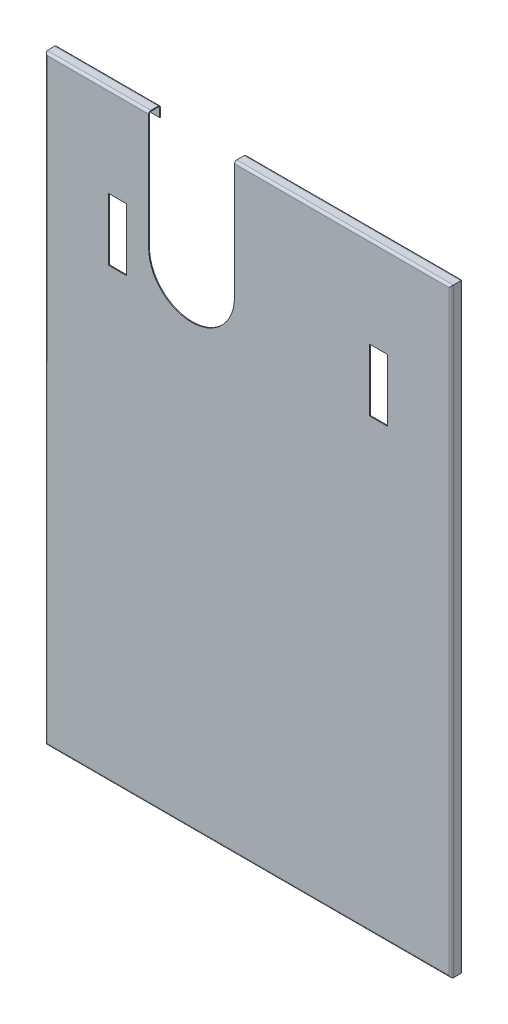
from build123d import *

# Parameters (mm, degrees)
SKETCH_1_W          = 568
SKETCH_1_H          = 839
SKETCH_1_W_2        = 25
SKETCH_1_H_2        = 87
EXTRUDE_1_DEPTH     = 1.2
SKETCH_2_W          = 568
SKETCH_2_H          = 839
SKETCH_2_W_2        = 565.6
SKETCH_2_H_2        = 836.6
EXTRUDE_2_DEPTH     = 15.5
SKETCH_3_W          = 568
SKETCH_3_H          = 839
SKETCH_3_W_2        = 538
SKETCH_3_H_2        = 809
EXTRUDE_3_DEPTH     = 1.2
FILLET_1_R          = 2
FILLET_2_R          = 3.2
FILLET_3_R          = 3.2
CUT_EXTRUDE_1_DEPTH = 1014.323191287


with BuildPart() as part:
    # 스케치1 → 보스-돌출1 (new body)
    with BuildSketch(Plane.XY):
        with Locations((284, 419.5)):
            Rectangle(SKETCH_1_W, SKETCH_1_H)
        with Locations((101.5, 668.5)):
            Rectangle(SKETCH_1_W_2, SKETCH_1_H_2, mode=Mode.SUBTRACT)
        with Locations((466.5, 668.5)):
            Rectangle(SKETCH_1_W_2, SKETCH_1_H_2, mode=Mode.SUBTRACT)
    extrude(amount=EXTRUDE_1_DEPTH)

    # 스케치2 → 보스-돌출2 (add)
    with BuildSketch(Plane(origin=(0, 0, 0), x_dir=(-1, 0, 0), z_dir=(0, 0, -1))):
        with Locations((-284, 419.5)):
            Rectangle(SKETCH_2_W, SKETCH_2_H)
        with Locations((-284, 419.5)):
            Rectangle(SKETCH_2_W_2, SKETCH_2_H_2, mode=Mode.SUBTRACT)
    extrude(amount=EXTRUDE_2_DEPTH)

    # 스케치3 → 보스-돌출3 (add)
    with BuildSketch(Plane(origin=(0, 0, -15.5), x_dir=(-1, 0, 0), z_dir=(0, 0, -1))):
        with Locations((-284, 419.5)):
            Rectangle(SKETCH_3_W, SKETCH_3_H)
        with Locations((-284, 419.5)):
            Rectangle(SKETCH_3_W_2, SKETCH_3_H_2, mode=Mode.SUBTRACT)
    extrude(amount=-EXTRUDE_3_DEPTH)

    # 필렛1
    fillet_1_edges = [part.edges().sort_by_distance(p)[0] for p in [
        (1.2, 419.5, 0),
        (284, 837.8, 0),
        (566.8, 419.5, 0),
        (284, 1.2, 0),
        (566.8, 1.2, -7.15),
        (1.2, 1.2, -7.15),
        (284, 1.2, -14.3),
        (566.8, 837.8, -7.15),
        (1.2, 837.8, -7.15),
        (1.2, 419.5, -14.3),
        (284, 837.8, -14.3),
        (566.8, 419.5, -14.3),
    ]]
    fillet(fillet_1_edges, radius=FILLET_1_R)

    # 필렛2
    fillet_2_edges = [part.edges().sort_by_distance(p)[0] for p in [
        (568, 419.5, 1.2),
        (284, 839, 1.2),
        (0, 419.5, 1.2),
        (284, 0, 1.2),
    ]]
    fillet(fillet_2_edges, radius=FILLET_2_R)

    # 필렛3
    fillet_3_edges = [part.edges().sort_by_distance(p)[0] for p in [
        (284, 0, -15.5),
        (0, 419.5, -15.5),
        (284, 839, -15.5),
        (568, 419.5, -15.5),
    ]]
    fillet(fillet_3_edges, radius=FILLET_3_R)

    # 스케치4 → 컷-돌출1 (cut, through all)
    with BuildSketch(Plane.XY.offset(1.2)):
        with BuildLine():
            Line((265, 952.257222416), (265, 674))
            ThreePointArc((265, 674), (205, 614), (145, 674))
            Line((145, 674), (145, 952.257222416))
            ThreePointArc((145, 952.257222416), (205, 1012.257222416), (265, 952.257222416))
        make_face()
    extrude(amount=-CUT_EXTRUDE_1_DEPTH, mode=Mode.SUBTRACT)


solid = part.part
